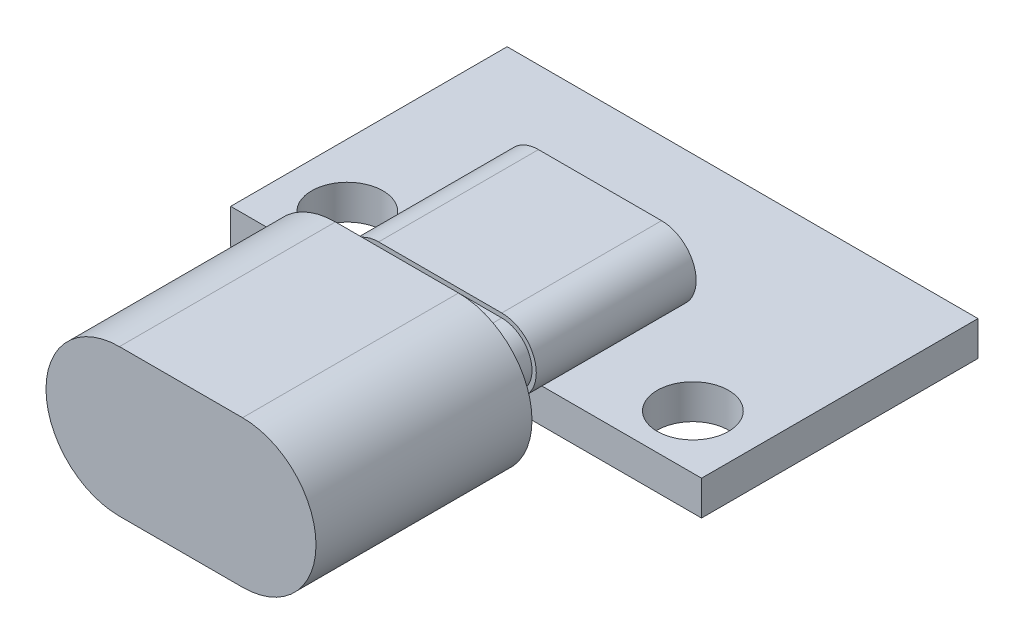
from build123d import *

# Parameters (mm, degrees)
SKETCH1_W           = 21.8
SKETCH1_H           = 12.8
BOSS_EXTRUDE1_DEPTH = 1.6
SKETCH2_R           = 1.65
CUT_EXTRUDE1_DEPTH  = 1.6
BOSS_EXTRUDE2_DEPTH = 7.4
BOSS_EXTRUDE3_DEPTH = 2
BOSS_EXTRUDE4_DEPTH = 10


with BuildPart() as part:
    # Sketch1 → Boss-Extrude1 (new body)
    with BuildSketch(Plane(origin=(0, 0, 0), x_dir=(1, 0, 0), z_dir=(0, 1, 0))):
        Rectangle(SKETCH1_W, SKETCH1_H)
    extrude(amount=BOSS_EXTRUDE1_DEPTH)

    # Sketch2 → Cut-Extrude1 (cut)
    with BuildSketch(Plane(origin=(0, 1.6, 0), x_dir=(1, 0, 0), z_dir=(0, 1, 0))):
        with Locations(Location((-8, -3.9, 0), (0, 0, 270))):
            Circle(SKETCH2_R)
        with Locations(Location((8, -3.9, 0), (0, 0, 270))):
            Circle(SKETCH2_R)
    extrude(amount=-CUT_EXTRUDE1_DEPTH, mode=Mode.SUBTRACT)

    # Sketch3 → Boss-Extrude2 (add)
    with BuildSketch(Plane.XY.offset(7.6)):
        with BuildLine():
            Line((-2.85, 4.8), (2.85, 4.8))
            ThreePointArc((2.85, 4.8), (4.45, 3.2), (2.85, 1.6))
            Line((2.85, 1.6), (-2.85, 1.6))
            ThreePointArc((-2.85, 1.6), (-4.45, 3.2), (-2.85, 4.8))
        make_face()
    extrude(amount=-BOSS_EXTRUDE2_DEPTH)

    # Sketch4 → Boss-Extrude3 (add)
    with BuildSketch(Plane.XY.offset(7.6)):
        with BuildLine():
            Line((-2.85, 1.8), (2.85, 1.8))
            ThreePointArc((2.85, 1.8), (4.25, 3.2), (2.85, 4.6))
            Line((2.85, 4.6), (-2.85, 4.6))
            ThreePointArc((-2.85, 4.6), (-4.25, 3.2), (-2.85, 1.8))
        make_face()
    extrude(amount=BOSS_EXTRUDE3_DEPTH)

    # Sketch5 → Boss-Extrude4 (add)
    with BuildSketch(Plane.XY.offset(9.6)):
        with BuildLine():
            Line((-2.85, -0.2), (2.85, -0.2))
            ThreePointArc((2.85, -0.2), (6.25, 3.2), (2.85, 6.6))
            Line((2.85, 6.6), (-2.85, 6.6))
            ThreePointArc((-2.85, 6.6), (-6.25, 3.2), (-2.85, -0.2))
        make_face()
    extrude(amount=BOSS_EXTRUDE4_DEPTH)


solid = part.part
